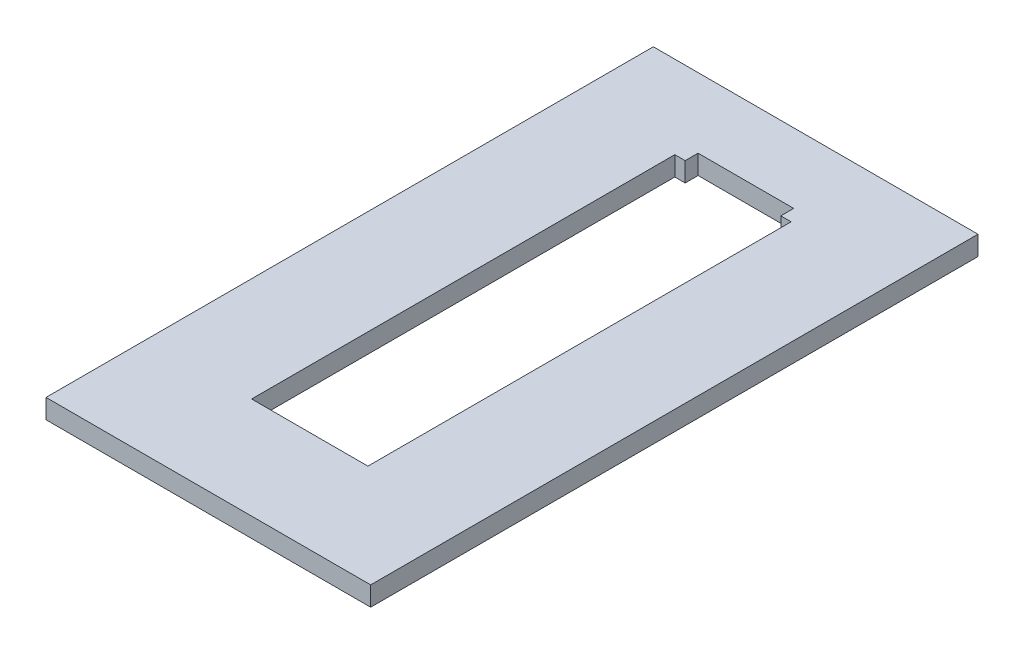
from build123d import *

# Parameters (mm, degrees)
SKETCH_1_W      = 5025
SKETCH_1_H      = 9400
EXTRUDE_1_DEPTH = 300


with BuildPart() as part:
    # Эскиз1 → Бобышка-Вытянуть1 (new body)
    with BuildSketch(Plane(origin=(0, 0, 0), x_dir=(1, 0, 0), z_dir=(0, 1, 0))):
        Rectangle(SKETCH_1_W, SKETCH_1_H)
        Polygon((900, -3130), (-900, -3130), (-900, 3420), (-740, 3420), (-740, 3620), (740, 3620), (740, 3420), (900, 3420), align=None, mode=Mode.SUBTRACT)
    extrude(amount=EXTRUDE_1_DEPTH)


solid = part.part
